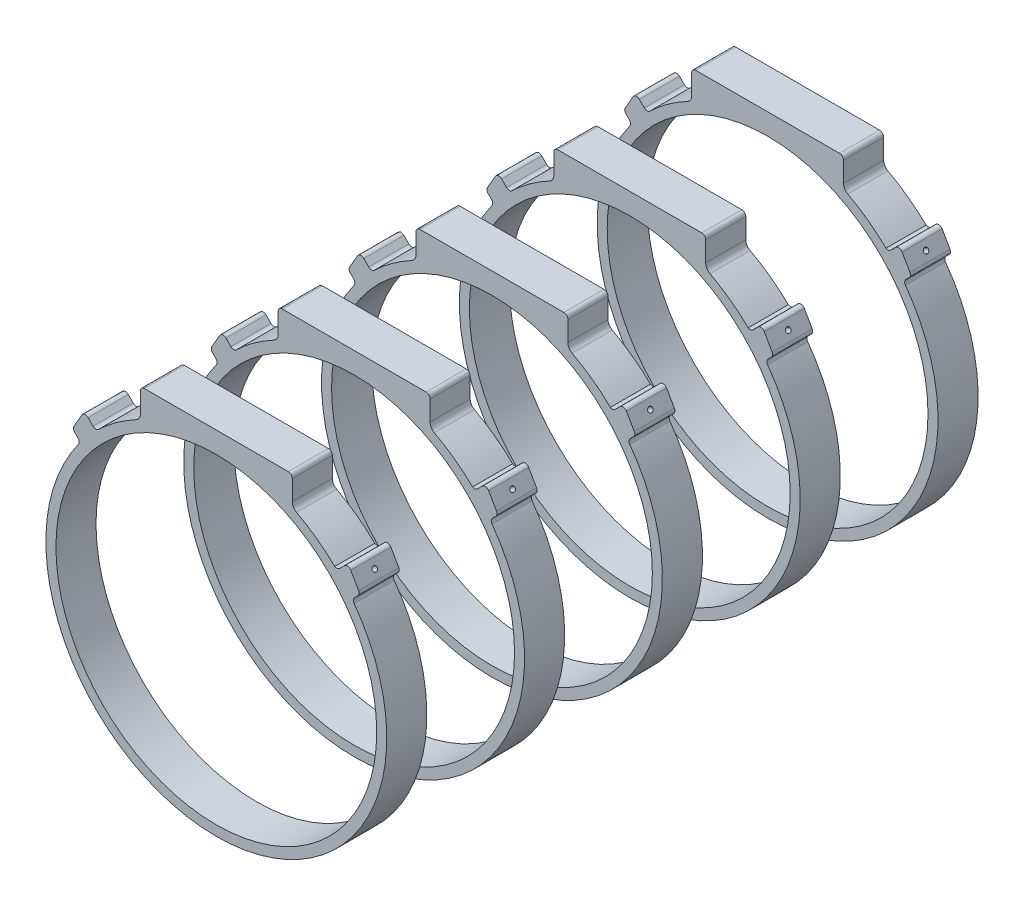
from build123d import *

# Parameters (mm, degrees)
SKETCH1_R           = 50.8
BOSS_EXTRUDE1_DEPTH = 12.7
LPATTERN2_COUNT     = 5
LPATTERN2_PITCH     = 43.6499
LPATTERN3_COUNT     = 5
LPATTERN3_PITCH     = 43.6499
LPATTERN4_COUNT     = 5
LPATTERN4_PITCH     = 43.6499


with BuildPart() as part:
    # Sketch1 → Boss-Extrude1 (new body)
    with BuildSketch(Plane.XY):
        with BuildLine():
            Line((-24.055294118, 56.216176471), (-24.055294118, 49.866176471))
            ThreePointArc((-24.055294118, 49.866176471), (-24.417262086, 48.559357252), (-25.4, 47.625))
            ThreePointArc((-25.4, 47.625), (-31.759819314, 43.641889305), (-37.505739075, 38.815205287))
            ThreePointArc((-37.505739075, 38.815205287), (-38.300552989, 38.664868971), (-39.024913478, 39.024913478))
            Line((-39.024913478, 39.024913478), (-40.5878612, 40.5878612))
            ThreePointArc((-40.5878612, 40.5878612), (-41.651655076, 40.948970562), (-42.585739075, 40.324835588))
            Line((-42.585739075, 40.324835588), (-45.080938326, 36.00302371))
            ThreePointArc((-45.080938326, 36.00302371), (-45.240221037, 35.202255446), (-44.879111675, 34.469998098))
            Line((-44.879111675, 34.469998098), (-43.788893028, 33.379779451))
            ThreePointArc((-43.788893028, 33.379779451), (-43.420975769, 32.581307014), (-43.659791369, 31.735205098))
            ThreePointArc((-43.659791369, 31.735205098), (-51.331461425, 16.684774284), (-53.975, 0))
            ThreePointArc((-53.975, 0), (-53.865614909, -3.434553173), (-53.537902992, -6.855185497))
            ThreePointArc((-53.537902992, -6.855185497), (0, -53.975), (53.537902992, -6.855185497))
            ThreePointArc((53.537902992, -6.855185497), (53.865614909, -3.434553173), (53.975, 0))
            ThreePointArc((53.975, 0), (51.331461425, 16.684774284), (43.659791369, 31.735205098))
            ThreePointArc((43.659791369, 31.735205098), (43.420975769, 32.581307014), (43.788893028, 33.379779451))
            Line((43.788893028, 33.379779451), (44.879111675, 34.469998098))
            ThreePointArc((44.879111675, 34.469998098), (45.240221037, 35.202255446), (45.080938326, 36.00302371))
            Line((45.080938326, 36.00302371), (42.585739075, 40.324835588))
            ThreePointArc((42.585739075, 40.324835588), (41.651655076, 40.948970562), (40.5878612, 40.5878612))
            Line((40.5878612, 40.5878612), (39.024913478, 39.024913478))
            ThreePointArc((39.024913478, 39.024913478), (38.300552989, 38.664868971), (37.505739075, 38.815205287))
            ThreePointArc((37.505739075, 38.815205287), (31.759819314, 43.641889305), (25.4, 47.625))
            ThreePointArc((25.4, 47.625), (24.417262086, 48.559357252), (24.055294118, 49.866176471))
            Line((24.055294118, 49.866176471), (24.055294118, 56.216176471))
            ThreePointArc((24.055294118, 56.216176471), (23.68331973, 57.114202083), (22.785294118, 57.486176471))
            Line((22.785294118, 57.486176471), (-22.785294118, 57.486176471))
            ThreePointArc((-22.785294118, 57.486176471), (-23.68331973, 57.114202083), (-24.055294118, 56.216176471))
        make_face()
        Circle(SKETCH1_R, mode=Mode.SUBTRACT)
    extrude(amount=BOSS_EXTRUDE1_DEPTH)


with BuildPart() as lpattern2_1:
    # LPattern2: pattern copy
    add(part.part.moved(Location(Vector(0, 0, 1) * (1 * LPATTERN2_PITCH))))


with BuildPart() as lpattern2_2:
    # LPattern2: pattern copy
    add(part.part.moved(Location(Vector(0, 0, 1) * (2 * LPATTERN2_PITCH))))


with BuildPart() as lpattern2_3:
    # LPattern2: pattern copy
    add(part.part.moved(Location(Vector(0, 0, 1) * (3 * LPATTERN2_PITCH))))


with BuildPart() as lpattern2_4:
    # LPattern2: pattern copy
    add(part.part.moved(Location(Vector(0, 0, 1) * (4 * LPATTERN2_PITCH))))


with BuildPart() as part_1:
    add(part.part)

    # Sketch7 → 1/16 (0.0625) Diameter Hole1 (revolve, cut)
    with BuildSketch(Plane(origin=(-43.8333387, 38.163929649, 6.35), x_dir=(-0.5000000000000032, -0.8660254037844369, 0), z_dir=(0, 0, 1))):
        Polygon((0, 0), (0, 3.81), (0.79375, 3.333066884), (0.79375, 0), align=None)
    f_1_16_0_0625_diameter_hole1 = revolve(axis=Axis((-49.332600014, 41.338929649, 6.35), (0.8660254037844367, -0.5000000000000031, 0)), mode=Mode.SUBTRACT)

    # Sketch10 → 1/16 (0.0625) Diameter Hole2 (revolve, cut)
    with BuildSketch(Plane(origin=(43.8333387, 38.163929649, 6.35), x_dir=(-0.49999999999989686, 0.8660254037844983, 0), z_dir=(0, 0, 1))):
        Polygon((0, 0), (0, 3.81), (0.79375, 3.333066884), (0.79375, 0), align=None)
    f_1_16_0_0625_diameter_hole2 = revolve(axis=Axis((49.332600014, 41.338929649, 6.35), (-0.8660254037844981, -0.49999999999989675, 0)), mode=Mode.SUBTRACT)


with BuildPart() as lpattern3_tool:
    # LPattern3: 1/16 (0.0625) Diameter Hole1 ×5
    with Locations(*[(0, 0, i * LPATTERN3_PITCH) for i in range(1, LPATTERN3_COUNT)]):
        add(f_1_16_0_0625_diameter_hole1)


with BuildPart() as lpattern2_1_1:
    add(lpattern2_1.part)

    # LPattern3: cut by lpattern3_tool
    add(lpattern3_tool.part, mode=Mode.SUBTRACT)


with BuildPart() as lpattern2_2_1:
    add(lpattern2_2.part)

    # LPattern3: cut by lpattern3_tool
    add(lpattern3_tool.part, mode=Mode.SUBTRACT)


with BuildPart() as lpattern2_3_1:
    add(lpattern2_3.part)

    # LPattern3: cut by lpattern3_tool
    add(lpattern3_tool.part, mode=Mode.SUBTRACT)


with BuildPart() as lpattern2_4_1:
    add(lpattern2_4.part)

    # LPattern3: cut by lpattern3_tool
    add(lpattern3_tool.part, mode=Mode.SUBTRACT)


with BuildPart() as lpattern4_tool:
    # LPattern4: 1/16 (0.0625) Diameter Hole2 ×5
    with Locations(*[(0, 0, i * LPATTERN4_PITCH) for i in range(1, LPATTERN4_COUNT)]):
        add(f_1_16_0_0625_diameter_hole2)


with BuildPart() as lpattern2_1_2:
    add(lpattern2_1_1.part)

    # LPattern4: cut by lpattern4_tool
    add(lpattern4_tool.part, mode=Mode.SUBTRACT)


with BuildPart() as lpattern2_2_2:
    add(lpattern2_2_1.part)

    # LPattern4: cut by lpattern4_tool
    add(lpattern4_tool.part, mode=Mode.SUBTRACT)


with BuildPart() as lpattern2_3_2:
    add(lpattern2_3_1.part)

    # LPattern4: cut by lpattern4_tool
    add(lpattern4_tool.part, mode=Mode.SUBTRACT)


with BuildPart() as lpattern2_4_2:
    add(lpattern2_4_1.part)

    # LPattern4: cut by lpattern4_tool
    add(lpattern4_tool.part, mode=Mode.SUBTRACT)


solid = Compound([part_1.part, lpattern2_1_2.part, lpattern2_2_2.part, lpattern2_3_2.part, lpattern2_4_2.part])
